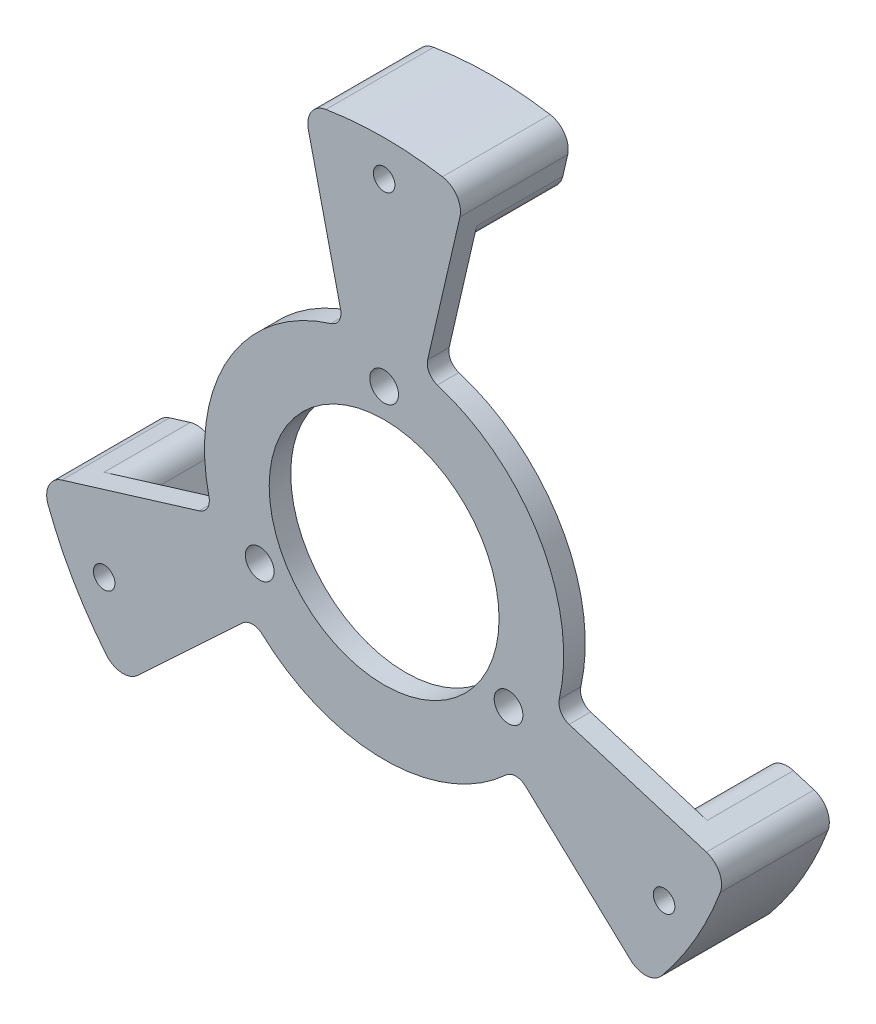
from build123d import *

# Parameters (mm, degrees)
SKETCH_1_R          = 16
SKETCH_1_R_2        = 2.0000000000000004
SKETCH_1_R_3        = 2.0000000000000013
SKETCH_1_R_4        = 1.9999999999999996
EXTRUDE_1_DEPTH     = 3
EXTRUDE_START       = 12
EXTRUDE_2_DEPTH     = 12
SKETCH_4_R          = 1.5000000000000009
SKETCH_4_R_2        = 1.5000000000024705
SKETCH_4_R_3        = 1.5000000000036489
CUT_EXTRUDE_1_DEPTH = 71.79051465905462
FILLET_1_R          = 2
FILLET_2_R          = 3


with BuildPart() as part:
    # 草图1 → 凸台-拉伸1 (new body)
    with BuildSketch(Plane.XY):
        with BuildLine():
            Line((5.623776358596461, 24.359251619630925), (11.247552717192923, 48.71850323926185))
            ThreePointArc((11.247552717192923, 48.71850323926185), (-3.7441e-13, 50.000000000000014), (-11.247552717193646, 48.71850323926167))
            Line((-11.247552717193646, 48.71850323926167), (-5.623776358596823, 24.359251619630832))
            ThreePointArc((-5.623776358596823, 24.359251619630832), (-21.650635094611058, 12.499999999999835), (-23.90761889907584, -7.309292618068593))
            Line((-23.90761889907584, -7.309292618068593), (-47.81523779815182, -14.61858523613672))
            ThreePointArc((-47.81523779815182, -14.61858523613672), (-43.30127018922199, -24.999999999999925), (-36.56768508095856, -34.099918003124884))
            Line((-36.56768508095856, -34.099918003124884), (-18.28384254047911, -17.04995900156262))
            ThreePointArc((-18.28384254047911, -17.04995900156262), (2.0137e-13, -24.999999999999996), (18.283842540479387, -17.04995900156234))
            Line((18.283842540479387, -17.04995900156234), (36.56768508095862, -34.09991800312487))
            ThreePointArc((36.56768508095862, -34.09991800312487), (43.30127018922202, -24.999999999999897), (47.815237798151834, -14.618585236136676))
            Line((47.815237798151834, -14.618585236136676), (23.907618899075946, -7.309292618068216))
            ThreePointArc((23.907618899075946, -7.309292618068216), (21.650635094610866, 12.500000000000162), (5.623776358596461, 24.359251619630925))
        make_face()
        Circle(SKETCH_1_R, mode=Mode.SUBTRACT)
        with Locations((1.302e-14, 20)):
            Circle(SKETCH_1_R_2, mode=Mode.SUBTRACT)
        with Locations((17.320508075688725, -10.000000000000092)):
            Circle(SKETCH_1_R_3, mode=Mode.SUBTRACT)
        with Locations((-17.320508075688874, -9.999999999999826)):
            Circle(SKETCH_1_R_4, mode=Mode.SUBTRACT)
    extrude(amount=EXTRUDE_1_DEPTH)

    # 草图3 → 凸台-拉伸2 (add)
    with BuildSketch(Plane(origin=(0, 0, 0), x_dir=(-1, 0, 0), z_dir=(0, 0, -1)).offset(EXTRUDE_START)):
        with BuildLine():
            Line((-11.247552717192923, 48.71850323926185), (-9.222993228098195, 39.949172656194705))
            ThreePointArc((-9.222993228098195, 39.949172656194705), (3.0294e-13, 41), (9.22299322809879, 39.94917265619457))
            Line((9.22299322809879, 39.94917265619457), (11.247552717193646, 48.71850323926167))
            ThreePointArc((11.247552717193646, 48.71850323926167), (3.8054e-13, 50), (-11.247552717192923, 48.71850323926185))
        make_face()
        with BuildLine():
            Line((47.815237798151635, -14.618585236137392), (39.20849499448435, -11.987239893632658))
            ThreePointArc((39.20849499448435, -11.987239893632658), (35.507041555161756, -20.500000000000437), (29.98550176638565, -27.96193276256283))
            Line((29.98550176638565, -27.96193276256283), (36.56768508095811, -34.099918003125396))
            ThreePointArc((36.56768508095811, -34.099918003125396), (43.30127018922164, -25.00000000000053), (47.815237798151635, -14.618585236137392))
        make_face()
        with BuildLine():
            Line((-36.56768508095907, -34.09991800312435), (-29.98550176638619, -27.96193276256223))
            ThreePointArc((-29.98550176638619, -27.96193276256223), (-35.50704155516215, -20.499999999999734), (-39.20849499448456, -11.987239893631878))
            Line((-39.20849499448456, -11.987239893631878), (-47.815237798152026, -14.618585236136003))
            ThreePointArc((-47.815237798152026, -14.618585236136003), (-43.30127018922234, -24.999999999999286), (-36.56768508095907, -34.09991800312435))
        make_face()
    extrude(amount=-EXTRUDE_2_DEPTH)

    # 草图4 → 切除-拉伸1 (cut, through all)
    with BuildSketch(Plane.XY.offset(3)):
        with Locations((0, 45)):
            Circle(SKETCH_4_R)
        with Locations((38.97114317030261, -22.499999999998334)):
            Circle(SKETCH_4_R_2)
        with Locations((-38.97114317029686, -22.500000000001673)):
            Circle(SKETCH_4_R_3)
    extrude(amount=-CUT_EXTRUDE_1_DEPTH, mode=Mode.SUBTRACT)

    # 圆角1
    fillet_1_edges = [part.edges().sort_by_distance(p)[0] for p in [
        (5.623776358596462, 24.359251619630925, 1.5),
        (23.907618899075946, -7.309292618068216, 1.5),
        (18.283842540479387, -17.049959001562343, 1.5),
        (-18.28384254047911, -17.04995900156262, 1.5),
        (-23.90761889907584, -7.309292618068593, 1.5),
        (-5.623776358596823, 24.359251619630832, 1.5),
    ]]
    fillet(fillet_1_edges, radius=FILLET_1_R)

    # 圆角2
    fillet_2_edges = [part.edges().sort_by_distance(p)[0] for p in [
        (11.24755271719292, 48.71850323926185, -4.5),
        (47.81523779815193, -14.61858523613634, -4.5),
        (36.567685080958846, -34.099918003124614, -4.5),
        (-36.56768508095834, -34.09991800312514, -4.5),
        (-47.81523779815173, -14.618585236137056, -4.5),
        (-11.247552717193646, 48.71850323926167, -4.5),
        (-39.208494994484354, -11.987239893632658, -6),
        (-29.985501766385653, -27.96193276256283, -6),
        (9.222993228098195, 39.949172656194705, -6),
        (-9.222993228098792, 39.94917265619457, -6),
        (29.98550176638619, -27.96193276256223, -6),
        (39.20849499448456, -11.987239893631878, -6),
    ]]
    fillet(fillet_2_edges, radius=FILLET_2_R)


solid = part.part
